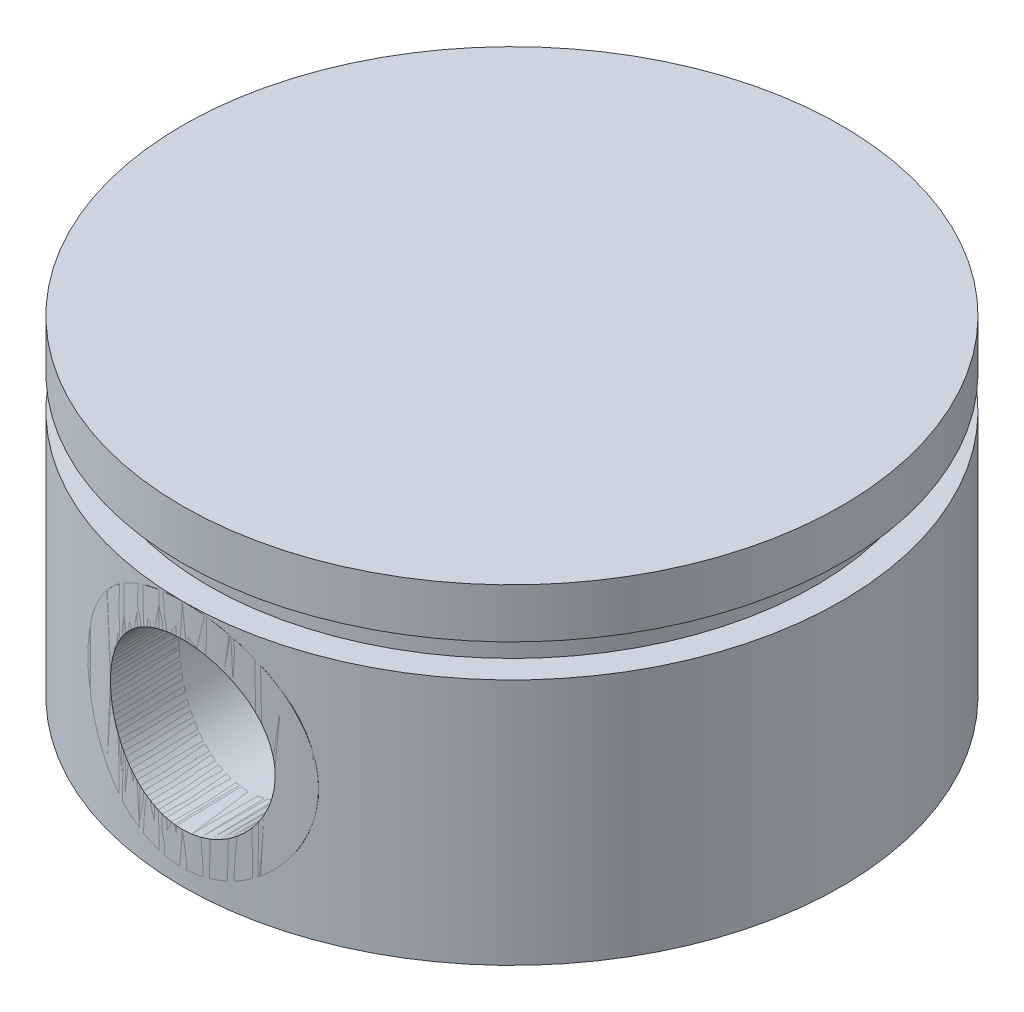
from build123d import *

# Parameters (mm, degrees)
ENL_V_MAT_EXTRU_1_DEPTH      = 87.602540378
ENL_V_MAT_EXTRU_1_DEPTH_BACK = 87.602540378
ESQUISSE2_R                  = 12.5
EXTRU_MINCE1_REACH           = 113.603
EXTRU_MINCE1_END_RADIUS      = 50
EXTRU_MINCE1_START           = 25
ESQUISSE2_2_R                = 17.5
ESQUISSE2_2_R_2              = 12.5
EXTRU_MINCE2_REACH           = 113.603
EXTRU_MINCE2_END_RADIUS      = 50
EXTRU_MINCE2_START           = -25
ESQUISSE2_3_R                = 17.5
ESQUISSE2_3_R_2              = 12.5


with BuildPart() as part:
    # Esquisse1 → Révolution1 (revolve)
    with BuildSketch(Plane.XY):
        Polygon((50, 0), (0, 0), (0, -10), (40, -10), (40, -50), (50, -50), (50, -12.5), (46, -12.5), (46, -7.5), (50, -7.5), align=None)
    revolve(axis=Axis((0, 0, 0), (0, -1, 0)))

    # Esquisse2 → Enlèv. mat.-Extru.1 (cut, two sides: drawn at the far end of the back side and taken through both)
    with BuildSketch(Plane.XY.offset(-ENL_V_MAT_EXTRU_1_DEPTH_BACK)):
        with Locations((0, -30)):
            Circle(ESQUISSE2_R)
    extrude(amount=ENL_V_MAT_EXTRU_1_DEPTH + ENL_V_MAT_EXTRU_1_DEPTH_BACK, mode=Mode.SUBTRACT)

    # Extru.-Mince2: up to this cylinder (the profile starts inside it)
    extru_mince2_end = Plane(origin=(0, -30, 0), z_dir=(0, 1, 0)) * Cylinder(EXTRU_MINCE2_END_RADIUS, 328.206, mode=Mode.PRIVATE)
    # Esquisse2<3> → Extru.-Mince2 (add, up to the surface)
    with BuildSketch(Plane.XY.offset(EXTRU_MINCE2_START), mode=Mode.PRIVATE) as extru_mince2_sk1:
        with Locations((0, -30)):
            Circle(ESQUISSE2_3_R)
        with Locations((0, -30)):
            Circle(ESQUISSE2_3_R_2, mode=Mode.SUBTRACT)
    extru_mince2_tool1 = extrude(extru_mince2_sk1.sketch, amount=-EXTRU_MINCE2_REACH, mode=Mode.PRIVATE) & extru_mince2_end
    add(extru_mince2_tool1.solids().sort_by_distance((-17.005025, -30, -25))[0])


with BuildPart() as body_2:
    # Extru.-Mince1: up to this cylinder (the profile starts inside it)
    extru_mince1_end = Plane(origin=(0, -30, 0), z_dir=(0, 1, 0)) * Cylinder(EXTRU_MINCE1_END_RADIUS, 328.206, mode=Mode.PRIVATE)
    # Esquisse2<2> → Extru.-Mince1 (new, up to the surface)
    with BuildSketch(Plane.XY.offset(EXTRU_MINCE1_START), mode=Mode.PRIVATE) as extru_mince1_sk1:
        with Locations((0, -30)):
            Circle(ESQUISSE2_2_R)
        with Locations((0, -30)):
            Circle(ESQUISSE2_2_R_2, mode=Mode.SUBTRACT)
    extru_mince1_tool1 = extrude(extru_mince1_sk1.sketch, amount=EXTRU_MINCE1_REACH, mode=Mode.PRIVATE) & extru_mince1_end
    add(extru_mince1_tool1.solids().sort_by_distance((-17.005025, -30, 25))[0])


solid = Compound([part.part, body_2.part])
